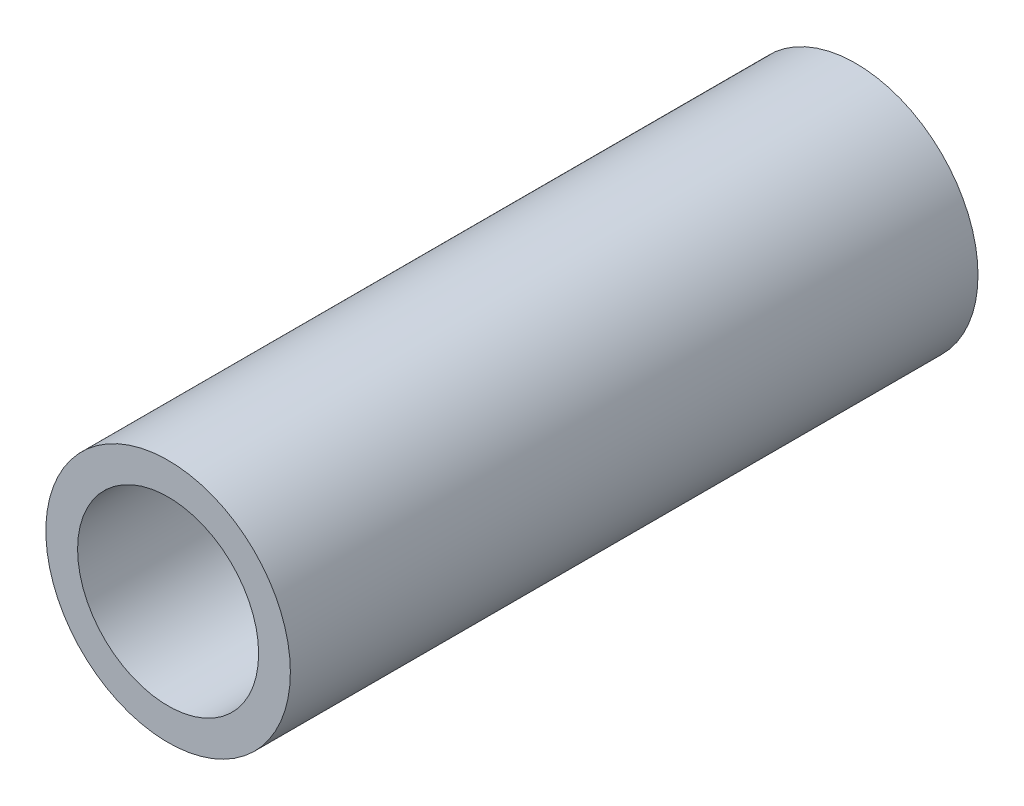
from build123d import *

# Parameters (mm, degrees)
SKETCH1_R           = 10.668
SKETCH1_R_2         = 7.8994
EXTRUDE_THIN1_DEPTH = 30


with BuildPart() as part:
    # Sketch1 → Extrude-Thin1 (new, symmetric)
    with BuildSketch(Plane.XY):
        Circle(SKETCH1_R)
        Circle(SKETCH1_R_2, mode=Mode.SUBTRACT)
    extrude(amount=EXTRUDE_THIN1_DEPTH, both=True)


solid = part.part
